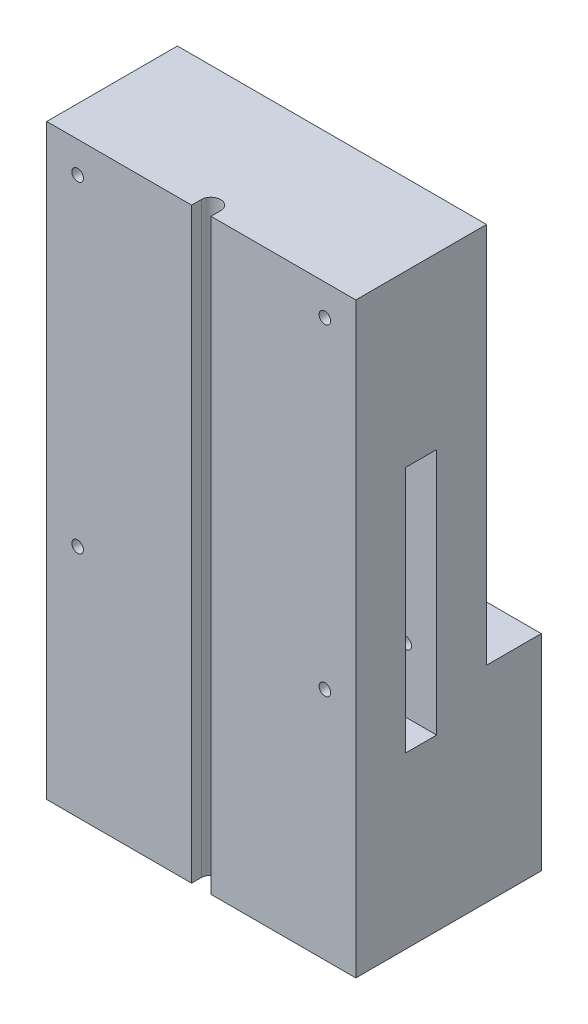
from build123d import *

# Parameters (mm, degrees)
SKETCH1_W           = 127
SKETCH1_H           = 241.3
BOSS_EXTRUDE1_DEPTH = 38.1
CUT_EXTRUDE1_REACH  = 254.408
SKETCH3_W           = 25.146
SKETCH3_H           = 81.026
CUT_EXTRUDE2_DEPTH  = 37.5875
SKETCH4_W           = 56.27
SKETCH4_H           = 8.636
CUT_EXTRUDE3_DEPTH  = 61.9125
SKETCH5_W           = 127
SKETCH5_H           = 156.845
CUT_EXTRUDE4_DEPTH  = 22.4917
CUT_EXTRUDE5_REACH  = 148.538
SKETCH6_R           = 2.38125
SKETCH7_W           = 12.7
SKETCH7_H           = 101.6
CUT_EXTRUDE6_DEPTH  = 12.7


with BuildPart() as part:
    # Sketch1 → Boss-Extrude1 (new, symmetric)
    with BuildSketch(Plane.XY):
        Rectangle(SKETCH1_W, SKETCH1_H)
    extrude(amount=BOSS_EXTRUDE1_DEPTH, both=True)

    # Sketch2 → Cut-Extrude1 (cut, up to next)
    with BuildSketch(Plane(origin=(0, 120.65, 0), x_dir=(1, 0, 0), z_dir=(0, 1, 0)), mode=Mode.PRIVATE) as cut_extrude1_sk1:
        with BuildLine():
            Line((-3.96875, -38.1), (-3.96875, -34.13125))
            ThreePointArc((-3.96875, -34.13125), (0, -30.1625), (3.96875, -34.13125))
            Line((3.96875, -34.13125), (3.96875, -38.1))
            Line((3.96875, -38.1), (-3.96875, -38.1))
        make_face()
    cut_extrude1_tool1 = extrude(cut_extrude1_sk1.sketch, amount=-CUT_EXTRUDE1_REACH, mode=Mode.PRIVATE) & part.part
    add(cut_extrude1_tool1.solids().sort_by_distance((0, 120.65, 34.501732))[0], mode=Mode.SUBTRACT)

    # Sketch3 → Cut-Extrude2 (cut)
    with BuildSketch(Plane(origin=(0, 0, -38.1), x_dir=(-1, 0, 0), z_dir=(0, 0, -1))):
        Polygon((-37.614075, 78.105), (-37.614075, 57.8612), (-37.614075, 39.878), (-37.614075, 31.75), (-37.614075, 1.905), (-23.644075, 1.905), (-23.644075, 29.845), (-17.167075, 29.845), (-17.167075, 1.905), (1.120925, 1.905), (1.120925, 29.845), (4.295925, 29.845), (4.295925, 78.105), (-13.877775, 78.105), (-13.877775, 96.139), (-25.676075, 96.139), (-25.676075, 78.105), align=None)
        with Locations((32.108925, 42.418)):
            Rectangle(SKETCH3_W, SKETCH3_H)
    extrude(amount=-CUT_EXTRUDE2_DEPTH, mode=Mode.SUBTRACT)

    # Sketch4 → Cut-Extrude3 (cut)
    with BuildSketch(Plane(origin=(0, 0, -38.1), x_dir=(-1, 0, 0), z_dir=(0, 0, -1))):
        with Locations((-15.276925, 97.917)):
            Rectangle(SKETCH4_W, SKETCH4_H)
    extrude(amount=-CUT_EXTRUDE3_DEPTH, mode=Mode.SUBTRACT)

    # Sketch5 → Cut-Extrude4 (cut)
    with BuildSketch(Plane(origin=(0, 0, -38.1), x_dir=(-1, 0, 0), z_dir=(0, 0, -1))):
        with Locations((0, 42.2275)):
            Rectangle(SKETCH5_W, SKETCH5_H)
    extrude(amount=-CUT_EXTRUDE4_DEPTH, mode=Mode.SUBTRACT)

    # Sketch6 → Cut-Extrude5 (cut, up to next)
    with BuildSketch(Plane(origin=(0, 0, -15.6083), x_dir=(-1, 0, 0), z_dir=(0, 0, -1)), mode=Mode.PRIVATE) as cut_extrude5_sk1:
        with Locations((-50.8, -24.28875)):
            Circle(SKETCH6_R)
    cut_extrude5_tool1 = extrude(cut_extrude5_sk1.sketch, amount=-CUT_EXTRUDE5_REACH, mode=Mode.PRIVATE) & part.part
    # Sketch6 → Cut-Extrude5 (cut, up to next)
    with BuildSketch(Plane(origin=(0, 0, -15.6083), x_dir=(-1, 0, 0), z_dir=(0, 0, -1)), mode=Mode.PRIVATE) as cut_extrude5_sk2:
        with Locations((50.8, 107.95)):
            Circle(SKETCH6_R)
    cut_extrude5_tool2 = extrude(cut_extrude5_sk2.sketch, amount=-CUT_EXTRUDE5_REACH, mode=Mode.PRIVATE) & part.part
    # Sketch6 → Cut-Extrude5 (cut, up to next)
    with BuildSketch(Plane(origin=(0, 0, -15.6083), x_dir=(-1, 0, 0), z_dir=(0, 0, -1)), mode=Mode.PRIVATE) as cut_extrude5_sk3:
        with Locations((50.8, -24.28875)):
            Circle(SKETCH6_R)
    cut_extrude5_tool3 = extrude(cut_extrude5_sk3.sketch, amount=-CUT_EXTRUDE5_REACH, mode=Mode.PRIVATE) & part.part
    # Sketch6 → Cut-Extrude5 (cut, up to next)
    with BuildSketch(Plane(origin=(0, 0, -15.6083), x_dir=(-1, 0, 0), z_dir=(0, 0, -1)), mode=Mode.PRIVATE) as cut_extrude5_sk4:
        with Locations((-50.8, 107.95)):
            Circle(SKETCH6_R)
    cut_extrude5_tool4 = extrude(cut_extrude5_sk4.sketch, amount=-CUT_EXTRUDE5_REACH, mode=Mode.PRIVATE) & part.part
    add(cut_extrude5_tool1.solids().sort_by_distance((50.8, -24.28875, -15.6083))[0], mode=Mode.SUBTRACT)
    add(cut_extrude5_tool2.solids().sort_by_distance((-50.8, 107.95, -15.6083))[0], mode=Mode.SUBTRACT)
    add(cut_extrude5_tool3.solids().sort_by_distance((-50.8, -24.28875, -15.6083))[0], mode=Mode.SUBTRACT)
    add(cut_extrude5_tool4.solids().sort_by_distance((50.8, 107.95, -15.6083))[0], mode=Mode.SUBTRACT)

    # Sketch7 → Cut-Extrude6 (cut)
    with BuildSketch(Plane(origin=(63.5, 0, 0), x_dir=(0, 0, -1), z_dir=(1, 0, 0))):
        with Locations((-11.24585, 0)):
            Rectangle(SKETCH7_W, SKETCH7_H)
    extrude(amount=-CUT_EXTRUDE6_DEPTH, mode=Mode.SUBTRACT)


solid = part.part
